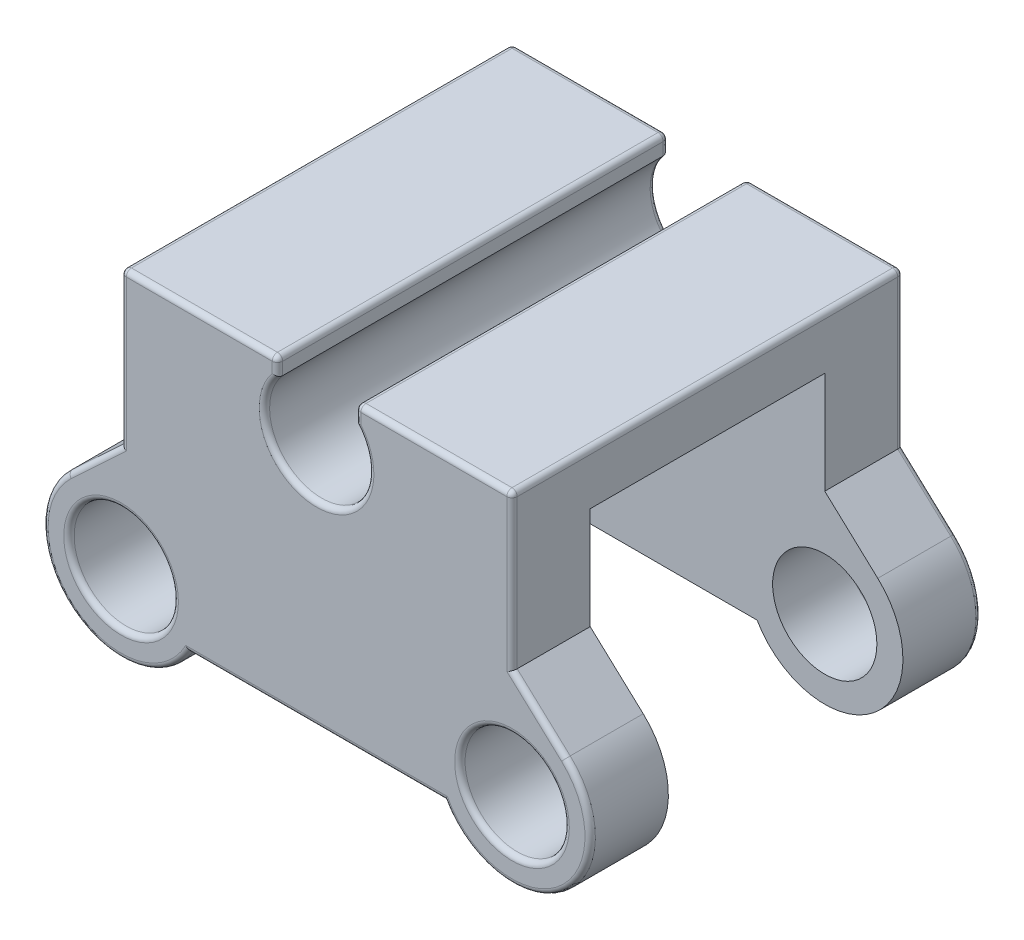
from build123d import *

# Parameters (mm, degrees)
EXTRUDE_1_DEPTH      = 4.5
EXTRUDE_1_DEPTH_BACK = 4.5
SKETCH_2_R           = 2
EXTRUDE_2_DEPTH      = 3
EXTRUDE_START        = -12
SKETCH_2_2_R         = 2
EXTRUDE_3_DEPTH      = 3
CUT_EXTRUDE_1_REACH  = 24.456
FILLET_1_R           = 0.2


with BuildPart() as part:
    # 草图1 → 凸台-拉伸1 (new, two sides: drawn at the far end of the back side and taken through both)
    with BuildSketch(Plane.XY.offset(-EXTRUDE_1_DEPTH_BACK)):
        with BuildLine():
            Line((3, -2), (7.5, -2))
            Line((7.5, -2), (7.5, 0))
            Line((7.5, 0), (1.5, 0))
            Line((1.5, 0), (-7.5, 0))
            Line((-7.5, 0), (-7.5, -2))
            Line((-7.5, -2), (-3, -2))
            ThreePointArc((-3, -2), (0, -5), (3, -2))
        make_face()
    extrude(amount=EXTRUDE_1_DEPTH + EXTRUDE_1_DEPTH_BACK)

    # 草图2 → 凸台-拉伸2 (add)
    with BuildSketch(Plane.XY.offset(4.5)):
        with BuildLine():
            Line((9.534364415, -7.795150475), (7.5, -5.918088786))
            Line((7.5, -5.918088786), (7.5, 0))
            Line((7.5, 0), (-7.5, 0))
            Line((-7.5, 0), (-7.5, -5.896942336))
            Line((-7.5, -5.896942336), (-9.546611511, -7.806513888))
            ThreePointArc((-9.546611511, -7.806513888), (-9.367214032, -12.348086829), (-4.901923789, -11.5))
            Line((-4.901923789, -11.5), (4.901923789, -11.5))
            ThreePointArc((4.901923789, -11.5), (9.373744979, -12.342878519), (9.534364415, -7.795150475))
        make_face()
        with Locations((-7.5, -10)):
            Circle(SKETCH_2_R, mode=Mode.SUBTRACT)
        with Locations((7.5, -10)):
            Circle(SKETCH_2_R, mode=Mode.SUBTRACT)
    extrude(amount=EXTRUDE_2_DEPTH)

    # 草图2<2> → 凸台-拉伸3 (add)
    with BuildSketch(Plane.XY.offset(4.5).offset(EXTRUDE_START)):
        with BuildLine():
            Line((9.534364415, -7.795150475), (7.5, -5.918088786))
            Line((7.5, -5.918088786), (7.5, 0))
            Line((7.5, 0), (-7.5, 0))
            Line((-7.5, 0), (-7.5, -5.896942336))
            Line((-7.5, -5.896942336), (-9.546611511, -7.806513888))
            ThreePointArc((-9.546611511, -7.806513888), (-9.367214032, -12.348086829), (-4.901923789, -11.5))
            Line((-4.901923789, -11.5), (4.901923789, -11.5))
            ThreePointArc((4.901923789, -11.5), (9.373744979, -12.342878519), (9.534364415, -7.795150475))
        make_face()
        with Locations((-7.5, -10)):
            Circle(SKETCH_2_2_R, mode=Mode.SUBTRACT)
        with Locations((7.5, -10)):
            Circle(SKETCH_2_2_R, mode=Mode.SUBTRACT)
    extrude(amount=EXTRUDE_3_DEPTH)

    # 草图3 → 切除-拉伸1 (cut, up to next)
    with BuildSketch(Plane.XY.offset(7.5), mode=Mode.PRIVATE) as cut_extrude_1_sk1:
        with BuildLine():
            Line((-1.5, 0), (1.5, 0))
            Line((1.5, 0), (1.5, -0.677124344))
            ThreePointArc((1.5, -0.677124344), (0, -4), (-1.5, -0.677124344))
            Line((-1.5, -0.677124344), (-1.5, 0))
        make_face()
    cut_extrude_1_tool1 = extrude(cut_extrude_1_sk1.sketch, amount=-CUT_EXTRUDE_1_REACH, mode=Mode.PRIVATE) & part.part
    add(cut_extrude_1_tool1.solids().sort_by_distance((0, -1.914707, 7.5))[0], mode=Mode.SUBTRACT)

    # 圆角1
    fillet_1_edges = [part.edges().sort_by_distance(p)[0] for p in [
        (-7.5, 0, 0),
        (-1.5, 0, 0),
        (7.5, 0, 0),
        (1.5, 0, 0),
        (-7.5, -2.948471168, -7.5),
        (-8.523305756, -6.851728112, -7.5),
        (-9.367214032, -12.348086829, -7.5),
        (0, -11.5, -7.5),
        (9.373744979, -12.342878519, -7.5),
        (8.517182208, -6.856619631, -7.5),
        (7.5, -2.959044393, -7.5),
        (4.5, 0, -7.5),
        (1.5, -0.338562172, -7.5),
        (0, -4, -7.5),
        (-1.5, -0.338562172, -7.5),
        (-4.5, 0, -7.5),
        (-9.5, -10, -7.5),
        (5.5, -10, -7.5),
        (5.5, -10, 7.5),
        (-9.5, -10, 7.5),
        (0, -4, 7.5),
        (1.5, -0.338562172, 7.5),
        (4.5, 0, 7.5),
        (7.5, -2.959044393, 7.5),
        (8.517182208, -6.856619631, 7.5),
        (9.373744979, -12.342878519, 7.5),
        (0, -11.5, 7.5),
        (-9.367214032, -12.348086829, 7.5),
        (-8.523305756, -6.851728112, 7.5),
        (-7.5, -2.948471168, 7.5),
        (-4.5, 0, 7.5),
        (-1.5, -0.338562172, 7.5),
    ]]
    fillet(fillet_1_edges, radius=FILLET_1_R)


solid = part.part
